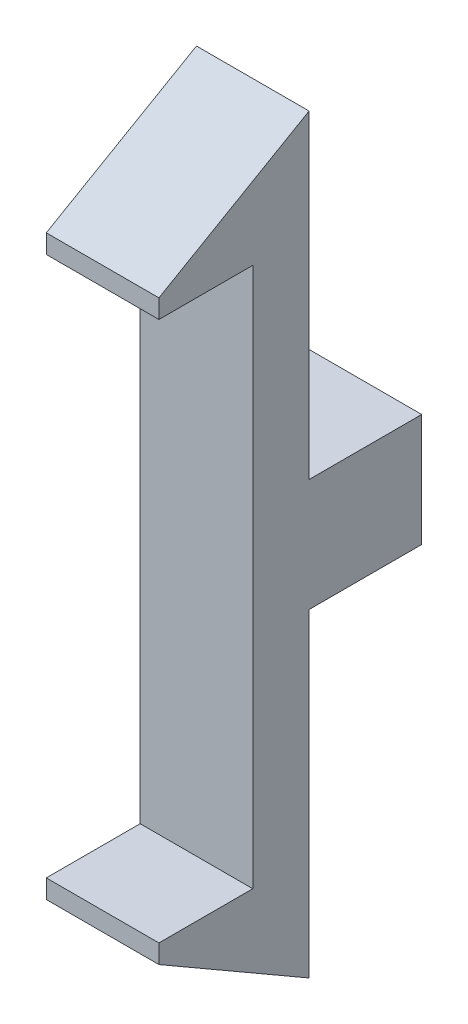
from build123d import *

# Parameters (mm, degrees)
SKETCH1_W           = 30
SKETCH1_H           = 30
BOSS_EXTRUDE1_DEPTH = 30
BOSS_EXTRUDE2_DEPTH = 15


with BuildPart() as part:
    # Sketch1 → Boss-Extrude1 (new body)
    with BuildSketch(Plane.XY):
        Rectangle(SKETCH1_W, SKETCH1_H)
    extrude(amount=BOSS_EXTRUDE1_DEPTH)

    # Sketch2 → Boss-Extrude2 (add, symmetric)
    with BuildSketch(Plane(origin=(0, 0, 0), x_dir=(0, 0, -1), z_dir=(1, 0, 0))):
        Polygon((-30, 15), (-30, 100), (-70, 76.905989232), (-70, 71.905989232), (-45, 71.905989232), (-45, 0), (-30, 0), align=None)
    boss_extrude2 = extrude(amount=BOSS_EXTRUDE2_DEPTH, both=True)

    # Mirror1: Boss-Extrude2 across plane
    add(boss_extrude2.mirror(Plane.ZX))


solid = part.part
